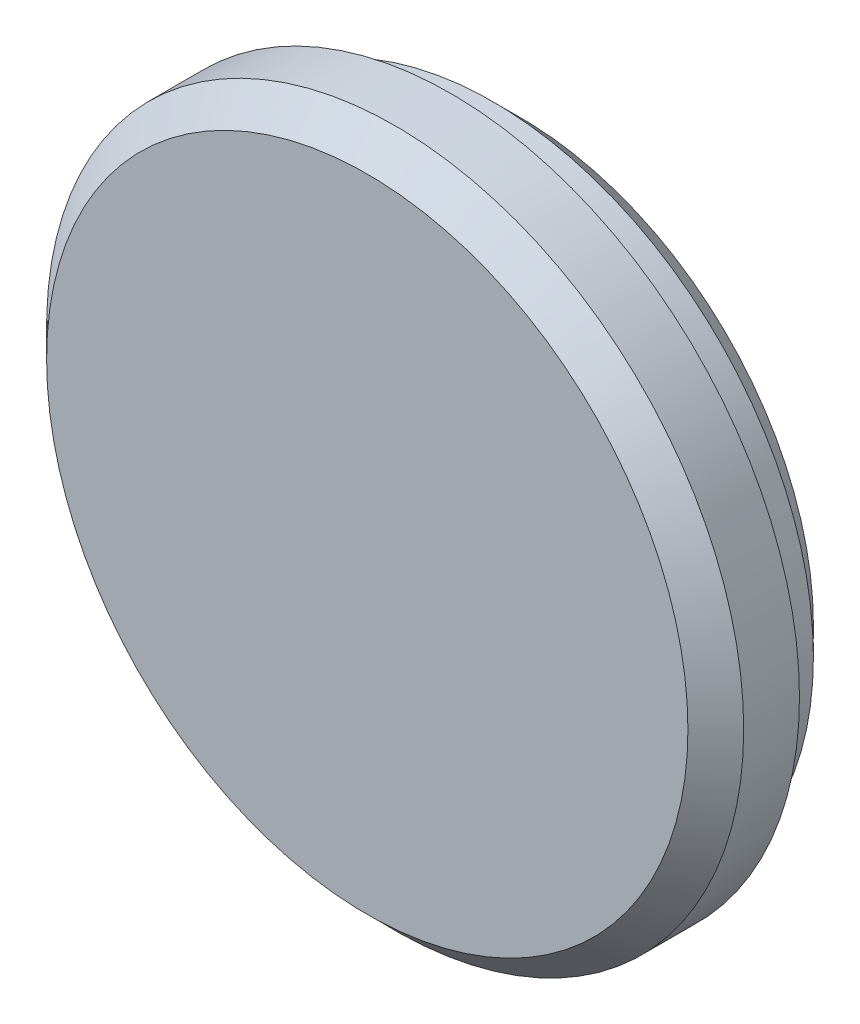
from build123d import *

# Parameters (mm, degrees)
SKETCH1_R                = 12.5
CORPO_DEPTH              = 3
SKETCH2_R                = 11.5
SKETCH2_R_2              = 8.5
EIXO_DE_ENCAIXE_20_DEPTH = 2.5
CHANFRO_1X45_SIZE        = 1


with BuildPart() as part:
    # Sketch1 → Corpo (new body)
    with BuildSketch(Plane.XY):
        Circle(SKETCH1_R)
    extrude(amount=-CORPO_DEPTH)

    # Sketch2 → Eixo de Encaixe - Ø20 (add)
    with BuildSketch(Plane(origin=(0, 0, -3), x_dir=(-1, 0, 0), z_dir=(0, 0, -1))):
        with Locations(Location((0, 0, 0), (0, 0, 180))):
            Circle(SKETCH2_R)
        Circle(SKETCH2_R_2, mode=Mode.SUBTRACT)
    extrude(amount=EIXO_DE_ENCAIXE_20_DEPTH)

    # Chanfro 1x45°
    chanfro_1x45_edges = [part.edges().sort_by_distance(p)[0] for p in [
        (-12.5, 0, 0),
        (-11.5, 0, -5.5),
        (8.5, 0, -5.5),
    ]]
    chamfer(chanfro_1x45_edges, length=CHANFRO_1X45_SIZE)


solid = part.part
